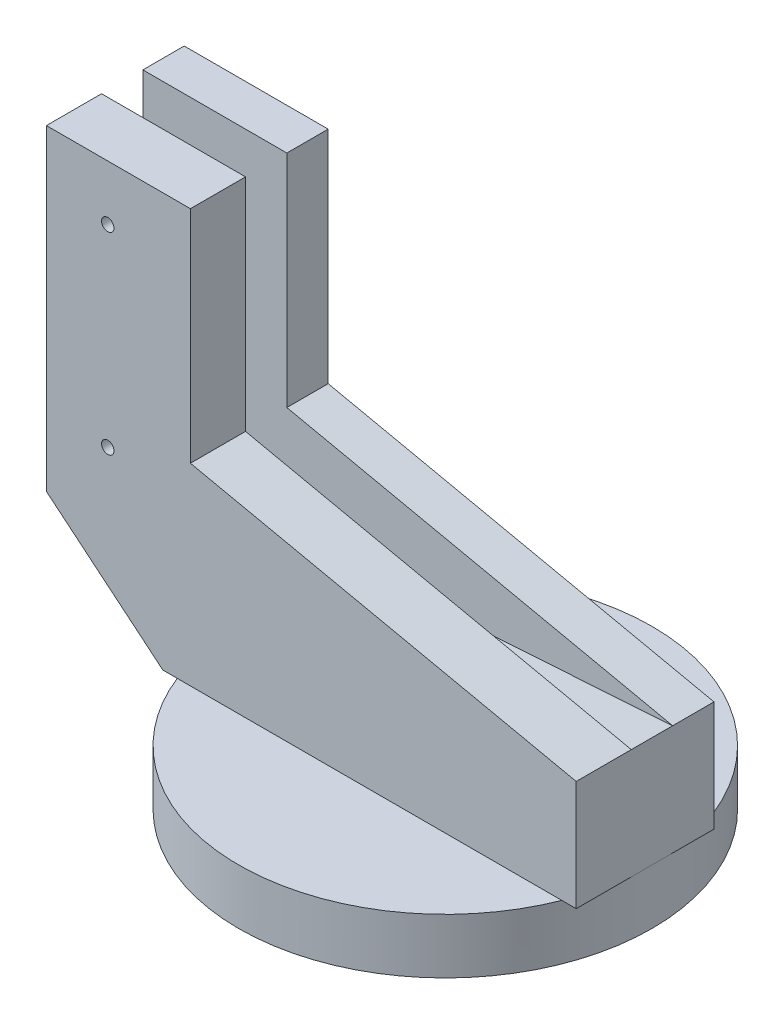
from build123d import *

# Parameters (mm, degrees)
SKETCH1_R           = 75
BOSS_EXTRUDE1_DEPTH = 20
BOSS_EXTRUDE2_DEPTH = 7.5
BOSS_EXTRUDE3_START = 7.5
SKETCH2_4_R         = 2.25
BOSS_EXTRUDE3_DEPTH = 20
BOSS_EXTRUDE4_START = -22.5
SKETCH2_5_R         = 2.25
BOSS_EXTRUDE4_DEPTH = 15


with BuildPart() as part:
    # Sketch1 → Boss-Extrude1 (new body)
    with BuildSketch(Plane(origin=(0, 0, 0), x_dir=(1, 0, 0), z_dir=(0, 1, 0))):
        with Locations(Location((0, 0, 0), (0, 0, 270))):
            Circle(SKETCH1_R)
    extrude(amount=BOSS_EXTRUDE1_DEPTH)

    # Sketch2 → Boss-Extrude2 (add, symmetric)
    with BuildSketch(Plane.XY):
        Polygon((75, 20), (-75, 20), (-117.25, 55), (0, 55), (75, 60), align=None)
    extrude(amount=BOSS_EXTRUDE2_DEPTH, both=True)

    # Sketch2<4> → Boss-Extrude3 (add)
    # profile 1 of 2: a face of its own
    with BuildSketch(Plane.XY.offset(BOSS_EXTRUDE3_START)):
        Polygon((-75, 20), (75, 20), (75, 60), (0, 55), (-117.25, 55), align=None)
    # profile 2 of 2: a face of its own
    with BuildSketch(Plane.XY.offset(BOSS_EXTRUDE3_START)):
        Polygon((0, 55), (75, 60), (-65, 90), (-65, 170), (-117.25, 170), (-117.25, 55), align=None)
        with Locations((-95, 80)):
            Circle(SKETCH2_4_R, mode=Mode.SUBTRACT)
        with Locations((-95, 150)):
            Circle(SKETCH2_4_R, mode=Mode.SUBTRACT)
    extrude(amount=BOSS_EXTRUDE3_DEPTH)

    # Sketch2<5> → Boss-Extrude4 (add)
    with BuildSketch(Plane.XY.offset(BOSS_EXTRUDE4_START)):
        Polygon((75, 20), (-75, 20), (-117.25, 55), (-117.25, 170), (-65, 170), (-65, 90), (75, 60), align=None)
        with Locations((-95, 150)):
            Circle(SKETCH2_5_R, mode=Mode.SUBTRACT)
        with Locations((-95, 80)):
            Circle(SKETCH2_5_R, mode=Mode.SUBTRACT)
    extrude(amount=BOSS_EXTRUDE4_DEPTH)


solid = part.part
